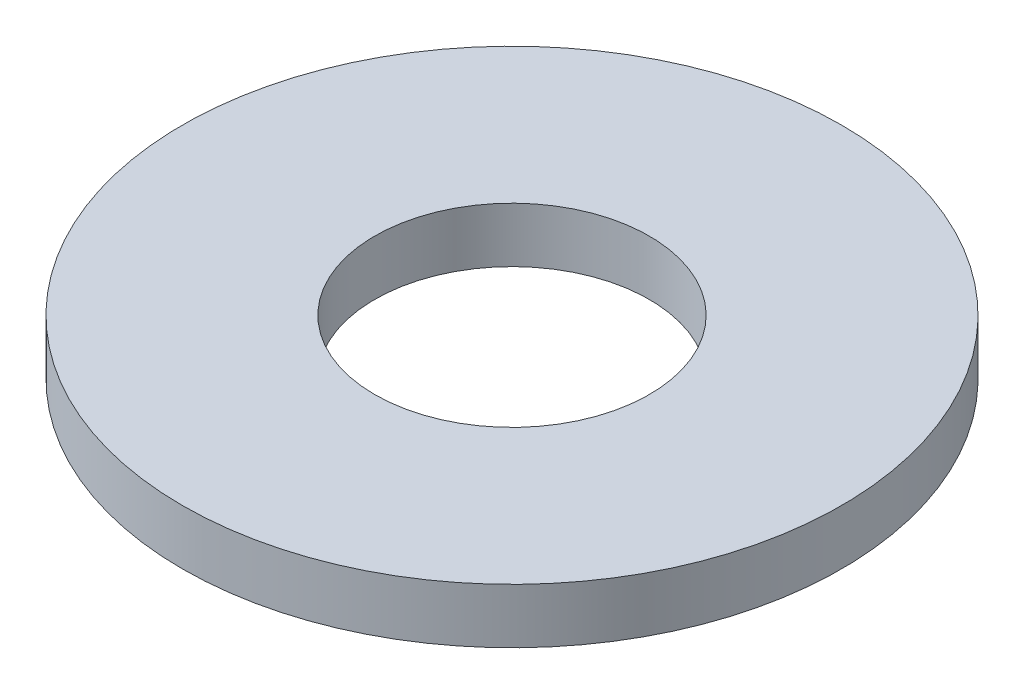
from build123d import *

# Parameters (mm, degrees)
SKETCH_1_R      = 6
SKETCH_1_R_2    = 2.5
EXTRUDE_1_DEPTH = 1


with BuildPart() as part:
    # 草图1 → 凸台-拉伸1 (new body)
    with BuildSketch(Plane(origin=(0, 0, 0), x_dir=(1, 0, 0), z_dir=(0, 1, 0))):
        with Locations(Location((0, 0, 0), (0, 0, 270))):
            Circle(SKETCH_1_R)
        with Locations(Location((0, 0, 0), (0, 0, 270))):
            Circle(SKETCH_1_R_2, mode=Mode.SUBTRACT)
    extrude(amount=EXTRUDE_1_DEPTH)


solid = part.part
